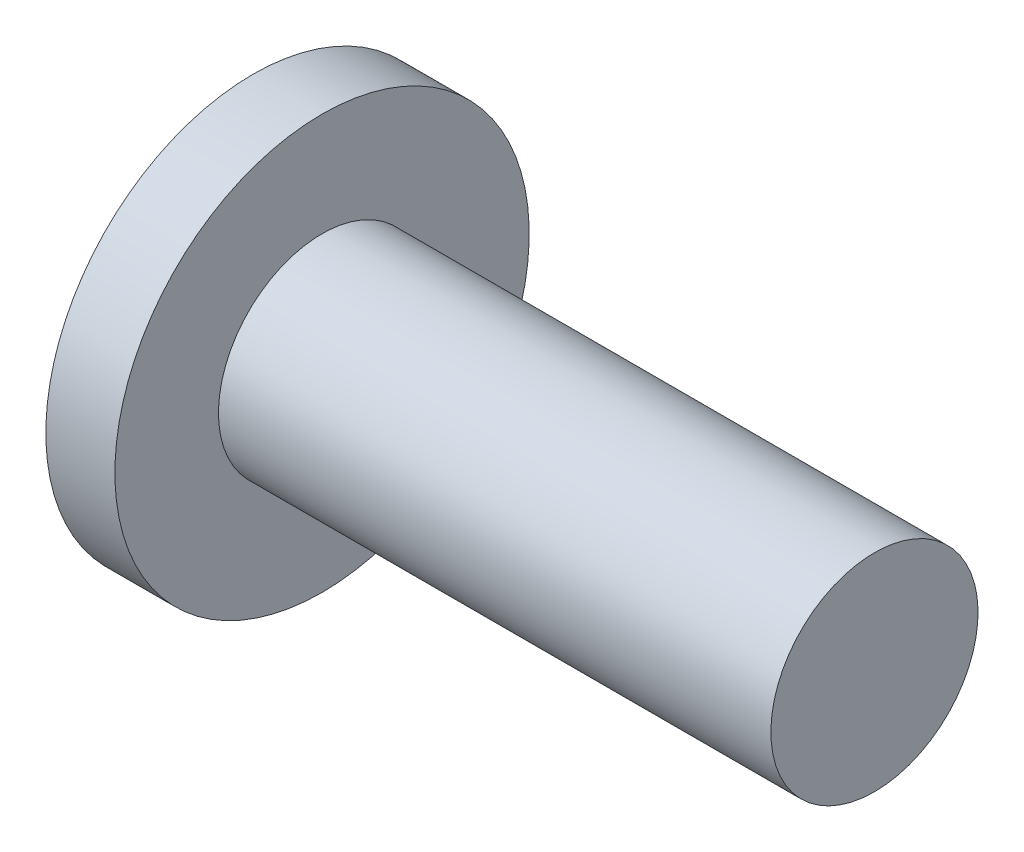
from build123d import *


with BuildPart() as part:
    # 草图1 → 旋转1 (revolve)
    with BuildSketch(Plane.XY, mode=Mode.PRIVATE) as revolve_1_sk:
        Polygon((0, 0), (8, 0), (8, -1.5), (-1, -1.5), (-1, 1.5), (0, 1.5), align=None)
    revolve(revolve_1_sk.sketch.rotate(Axis((-1, -1.5, 0), (1, 0, 0)), 180), axis=Axis((-1, -1.5, 0), (1, 0, 0)))


solid = part.part
